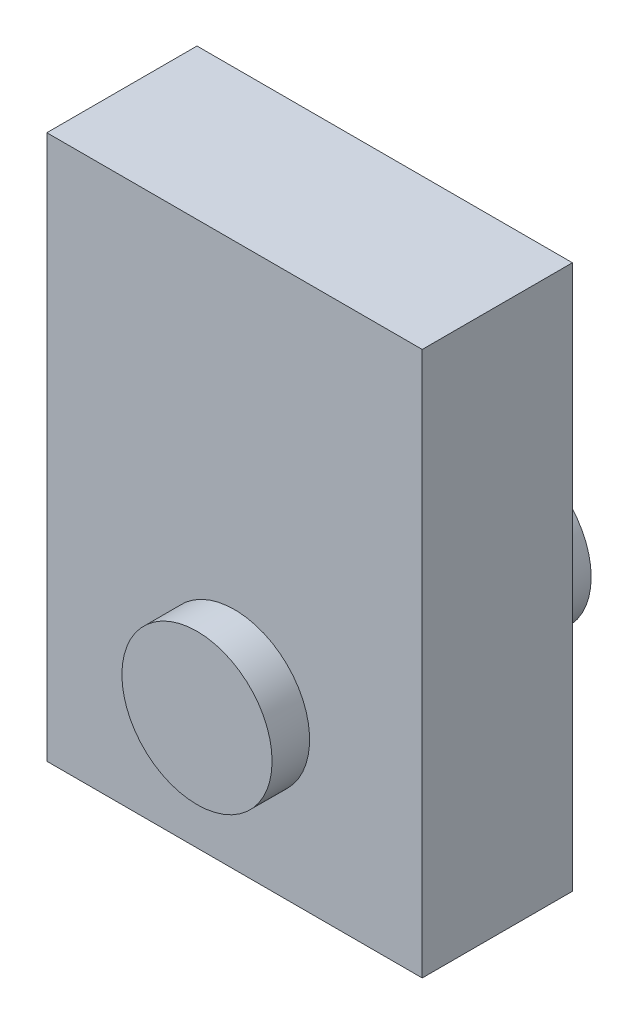
from build123d import *

# Parameters (mm, degrees)
SK_P01_HANGER_W       = 20
SK_P01_HANGER_H       = 8
P01_HANGER_DEPTH      = 29
P02_PIVOTPIN8MM_START = -8.5
SK_P02_PIVOTPIN8MM_R  = 4
P02_PIVOTPIN8MM_DEPTH = 17


with BuildPart() as part:
    # SK_P01_Hanger → P01_Hanger (new body)
    with BuildSketch(Plane(origin=(0, 0, 0), x_dir=(1, 0, 0), z_dir=(0, 1, 0))):
        with Locations((0, -2.5)):
            Rectangle(SK_P01_HANGER_W, SK_P01_HANGER_H)
    extrude(amount=P01_HANGER_DEPTH)

    # SK_P02_Pivotpin8mm → P02_Pivotpin8mm (add)
    with BuildSketch(Plane.XY.offset(P02_PIVOTPIN8MM_START)):
        with Locations((0, 8)):
            Circle(SK_P02_PIVOTPIN8MM_R)
    extrude(amount=P02_PIVOTPIN8MM_DEPTH)


solid = part.part
